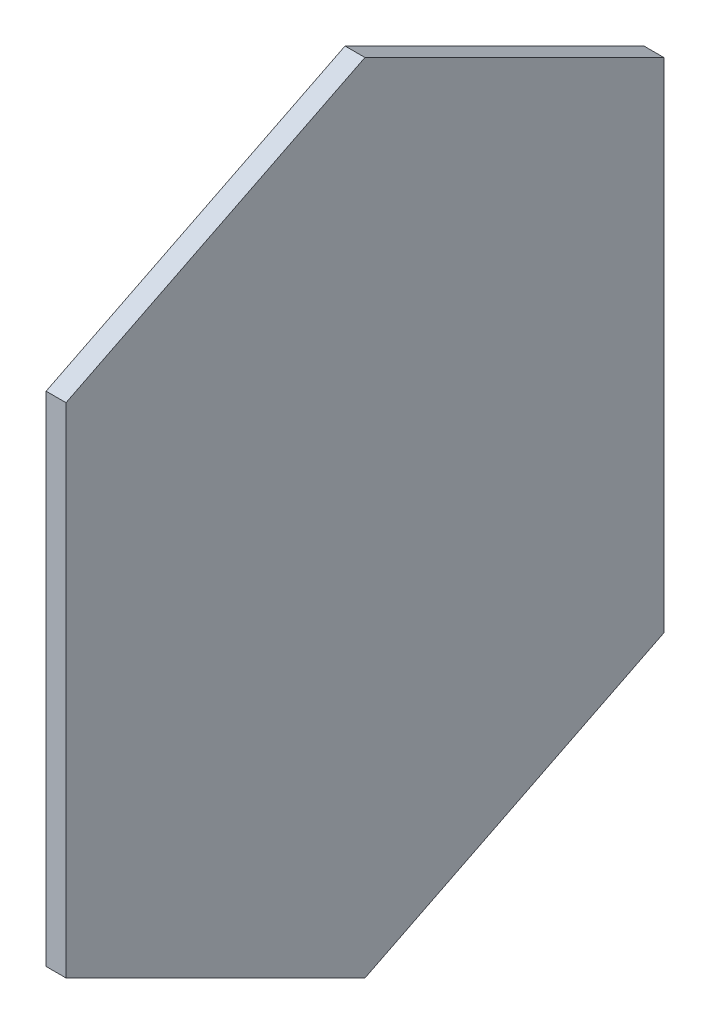
from build123d import *

# Parameters (mm, degrees)
BOSS_EXTRUDE1_DEPTH = 25.4


with BuildPart() as part:
    # Sketch1 → Boss-Extrude1 (new body)
    with BuildSketch(Plane(origin=(0, 0, 0), x_dir=(0, 0, -1), z_dir=(1, 0, 0))):
        Polygon((-381, 317.5), (-381, -317.5), (0, -508), (381, -317.5), (381, 317.5), (0, 508), align=None)
    extrude(amount=BOSS_EXTRUDE1_DEPTH)


solid = part.part
